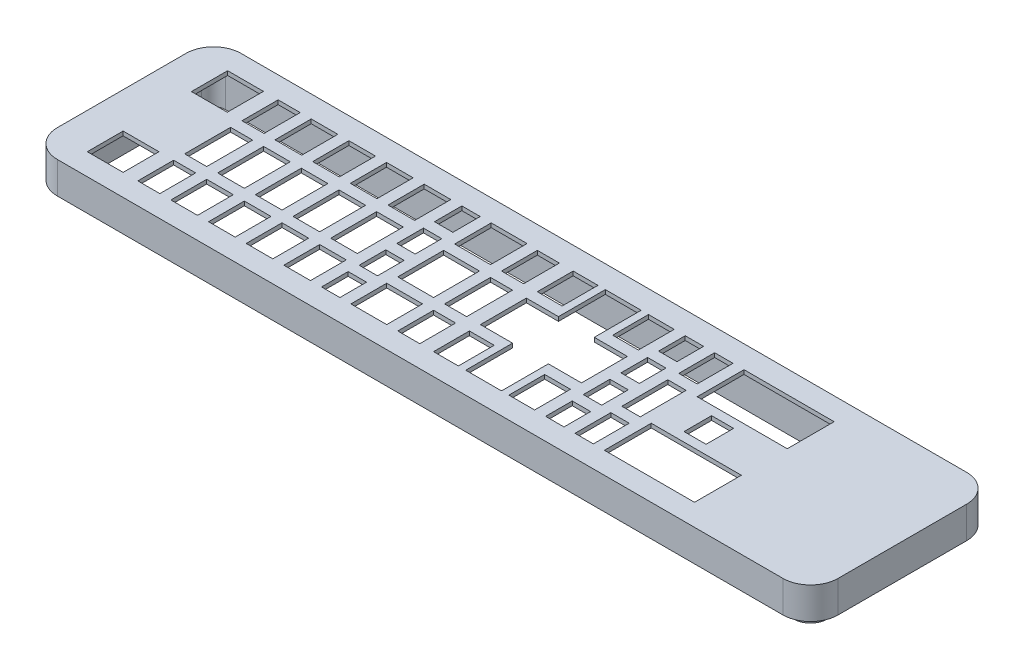
from build123d import *

# Parameters (mm, degrees)
SKETCH1_W           = 215.9
SKETCH1_H           = 50.8
BOSS_EXTRUDE1_DEPTH = 8.763
FILLET9_R           = 7.62
CUT_EXTRUDE2_DEPTH  = 7.62
BOSS_EXTRUDE2_DEPTH = 10.16
SKETCH4_W           = 9.906
SKETCH4_H           = 10.0076
SKETCH4_W_2         = 6.096
SKETCH4_H_2         = 12.7
SKETCH4_H_3         = 9.906
SKETCH4_W_3         = 7.366
SKETCH4_W_4         = 5.08
SKETCH4_H_4         = 7.5692
SKETCH4_H_5         = 7.366
SKETCH4_W_5         = 7.112
SKETCH4_H_6         = 10.1092
SKETCH4_W_6         = 6.858
SKETCH4_W_7         = 24.9174
SKETCH4_H_7         = 12.954
SKETCH4_H_8         = 7.62
CUT_EXTRUDE3_DEPTH  = 112.472509207


with BuildPart() as part:
    # Sketch1 → Boss-Extrude1 (new body)
    with BuildSketch(Plane(origin=(0, 0, 0), x_dir=(1, 0, 0), z_dir=(0, 1, 0))):
        Rectangle(SKETCH1_W, SKETCH1_H)
    extrude(amount=BOSS_EXTRUDE1_DEPTH)

    # Fillet9
    fillet9_edges = [part.edges().sort_by_distance(p)[0] for p in [
        (-107.95, 4.3815, -25.4),
        (-107.95, 4.3815, 25.4),
        (107.95, 4.3815, 25.4),
        (107.95, 4.3815, -25.4),
    ]]
    fillet(fillet9_edges, radius=FILLET9_R)

    # Sketch22 → Cut-Extrude2 (cut)
    with BuildSketch(Plane.XZ):
        with BuildLine():
            Line((106.172, -17.78), (106.172, 17.78))
            ThreePointArc((106.172, 17.78), (104.460917816, 21.910917816), (100.33, 23.622))
            Line((100.33, 23.622), (-100.33, 23.622))
            ThreePointArc((-100.33, 23.622), (-104.460917816, 21.910917816), (-106.172, 17.78))
            Line((-106.172, 17.78), (-106.172, -17.78))
            ThreePointArc((-106.172, -17.78), (-104.460917816, -21.910917816), (-100.33, -23.622))
            Line((-100.33, -23.622), (100.33, -23.622))
            ThreePointArc((100.33, -23.622), (104.460917816, -21.910917816), (106.172, -17.78))
        make_face()
    extrude(amount=-CUT_EXTRUDE2_DEPTH, mode=Mode.SUBTRACT)

    # Sketch23 → Boss-Extrude2 (add)
    with BuildSketch(Plane.XZ.offset(-7.62)):
        with BuildLine():
            Line((100.33, 22.352), (-100.33, 22.352))
            ThreePointArc((-100.33, 22.352), (-103.562892204, 21.012892204), (-104.902, 17.78))
            Line((-104.902, 17.78), (-104.902, -17.78))
            ThreePointArc((-104.902, -17.78), (-103.562892204, -21.012892204), (-100.33, -22.352))
            Line((-100.33, -22.352), (100.33, -22.352))
            ThreePointArc((100.33, -22.352), (103.562892204, -21.012892204), (104.902, -17.78))
            Line((104.902, -17.78), (104.902, 17.78))
            ThreePointArc((104.902, 17.78), (103.562892204, 21.012892204), (100.33, 22.352))
        make_face()
        with BuildLine():
            Line((-103.632, 17.78), (-103.632, -17.78))
            ThreePointArc((-103.632, -17.78), (-102.664866591, -20.114866591), (-100.33, -21.082))
            Line((-100.33, -21.082), (100.33, -21.082))
            ThreePointArc((100.33, -21.082), (102.664866591, -20.114866591), (103.632, -17.78))
            Line((103.632, -17.78), (103.632, 17.78))
            ThreePointArc((103.632, 17.78), (102.664866591, 20.114866591), (100.33, 21.082))
            Line((100.33, 21.082), (-100.33, 21.082))
            ThreePointArc((-100.33, 21.082), (-102.664866591, 20.114866591), (-103.632, 17.78))
        make_face(mode=Mode.SUBTRACT)
    extrude(amount=BOSS_EXTRUDE2_DEPTH)

    # Sketch4 → Cut-Extrude3 (cut, through all)
    with BuildSketch(Plane(origin=(0, 8.763, 0), x_dir=(1, 0, 0), z_dir=(0, 1, 0))):
        with Locations((-93.091, 14.4018)):
            Rectangle(SKETCH4_W, SKETCH4_H)
        with Locations((-9.144, -0.1016)):
            Rectangle(SKETCH4_W_2, SKETCH4_H_2)
        with Locations((-9.144, 14.2494)):
            Rectangle(SKETCH4_W_2, SKETCH4_H_3)
        Polygon((-2.286, 6.2484), (4.572, 6.2484), (6.604, 6.2484), (6.604, 8.89), (6.604, 19.2024), (16.51, 19.2024), (16.51, 8.89), (16.51, 6.2484), (18.796, 6.2484), (25.654, 6.2484), (25.654, -6.4516), (18.796, -6.4516), (16.51, -6.4516), (16.51, -19.4056), (6.604, -19.4056), (6.604, -8.89), (6.604, -6.4516), (4.572, -6.4516), (-2.286, -6.4516), align=None)
        with Locations((-81.026, 14.4018)):
            Rectangle(SKETCH4_W_2, SKETCH4_H)
        with Locations((-71.247, 14.4018)):
            Rectangle(SKETCH4_W_3, SKETCH4_H)
        with Locations((-60.833, 14.4018)):
            Rectangle(SKETCH4_W_3, SKETCH4_H)
        with Locations((-50.419, 14.4018)):
            Rectangle(SKETCH4_W_3, SKETCH4_H)
        with Locations((-40.005, 14.4018)):
            Rectangle(SKETCH4_W_3, SKETCH4_H)
        with Locations((-30.734, 15.621)):
            Rectangle(SKETCH4_W_4, SKETCH4_H_4)
        with Locations((39.37, 14.2494)):
            Rectangle(SKETCH4_W_4, SKETCH4_H_3)
        with Locations((31.242, 15.5194)):
            Rectangle(SKETCH4_W_4, SKETCH4_H_5)
        with Locations((22.098, 14.2494)):
            Rectangle(SKETCH4_W_5, SKETCH4_H_3)
        with Locations((-20.193, 14.351)):
            Rectangle(SKETCH4_W, SKETCH4_H_6)
        with Locations((1.143, 14.2494)):
            Rectangle(SKETCH4_W_6, SKETCH4_H_3)
        with Locations((-93.091, -14.4526)):
            Rectangle(SKETCH4_W, SKETCH4_H_3)
        with Locations((-30.734, 5.1054)):
            Rectangle(SKETCH4_W_4, SKETCH4_H_5)
        with Locations((-30.734, -5.3086)):
            Rectangle(SKETCH4_W_4, SKETCH4_H_5)
        with Locations((-81.026, -14.4526)):
            Rectangle(SKETCH4_W_2, SKETCH4_H_3)
        with Locations((-81.026, -0.1016)):
            Rectangle(SKETCH4_W_2, SKETCH4_H_2)
        with Locations((-40.005, -14.4526)):
            Rectangle(SKETCH4_W_3, SKETCH4_H_3)
        with Locations((-40.005, -0.1016)):
            Rectangle(SKETCH4_W_3, SKETCH4_H_2)
        with Locations((-50.419, -14.4526)):
            Rectangle(SKETCH4_W_3, SKETCH4_H_3)
        with Locations((-50.419, -0.1016)):
            Rectangle(SKETCH4_W_3, SKETCH4_H_2)
        with Locations((-60.833, -14.4526)):
            Rectangle(SKETCH4_W_3, SKETCH4_H_3)
        with Locations((-60.833, -0.1016)):
            Rectangle(SKETCH4_W_3, SKETCH4_H_2)
        with Locations((-71.247, -14.4526)):
            Rectangle(SKETCH4_W_3, SKETCH4_H_3)
        with Locations((-71.247, -0.1016)):
            Rectangle(SKETCH4_W_3, SKETCH4_H_2)
        with Locations((-30.734, -15.7226)):
            Rectangle(SKETCH4_W_4, SKETCH4_H_5)
        with Locations((-20.193, -14.4526)):
            Rectangle(SKETCH4_W, SKETCH4_H_3)
        with Locations((-20.193, -0.1016)):
            Rectangle(SKETCH4_W, SKETCH4_H_2)
        with Locations((-9.144, -14.4526)):
            Rectangle(SKETCH4_W_2, SKETCH4_H_3)
        with Locations((1.143, -14.4526)):
            Rectangle(SKETCH4_W_6, SKETCH4_H_3)
        with Locations((22.098, -14.4526)):
            Rectangle(SKETCH4_W_5, SKETCH4_H_3)
        with Locations((57.4167, 12.7254)):
            Rectangle(SKETCH4_W_7, SKETCH4_H_7)
        with Locations((39.37, -14.4526)):
            Rectangle(SKETCH4_W_4, SKETCH4_H_3)
        with Locations((39.37, -0.1016)):
            Rectangle(SKETCH4_W_4, SKETCH4_H_2)
        with Locations((31.242, -15.7226)):
            Rectangle(SKETCH4_W_4, SKETCH4_H_5)
        with Locations((31.242, -5.3086)):
            Rectangle(SKETCH4_W_4, SKETCH4_H_5)
        with Locations((31.242, 5.1054)):
            Rectangle(SKETCH4_W_4, SKETCH4_H_5)
        with Locations((57.4167, -12.9286)):
            Rectangle(SKETCH4_W_7, SKETCH4_H_7)
        with Locations((54.5338, -0.1016)):
            Rectangle(SKETCH4_W_2, SKETCH4_H_8)
    extrude(amount=-CUT_EXTRUDE3_DEPTH, mode=Mode.SUBTRACT)


solid = part.part
